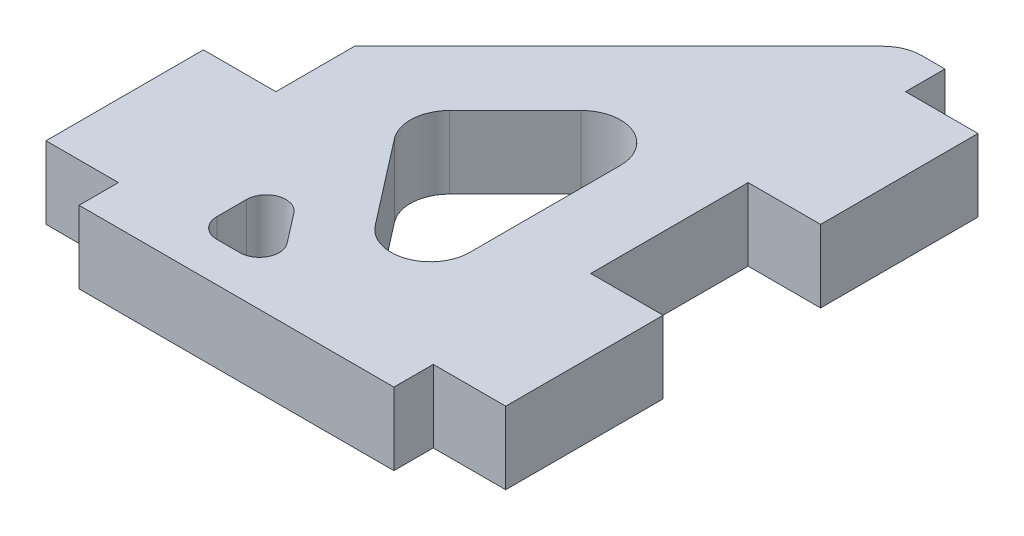
from build123d import *

# Parameters (mm, degrees)
BOSS_EXTRUDE1_DEPTH = 5.842
CUT_EXTRUDE1_DEPTH  = 39.907834083
FILLET1_R           = 3.175
FILLET2_R           = 1.5875
FILLET3_R           = 3.175
SKETCH3_W           = 25.4
SKETCH3_H           = 3.175
CUT_EXTRUDE2_DEPTH  = 39.907834083


with BuildPart() as part:
    # Sketch1 → Boss-Extrude1 (new body)
    with BuildSketch(Plane(origin=(0, 0, 0), x_dir=(1, 0, 0), z_dir=(0, 1, 0))):
        Polygon((15.875, -15.875), (-9.525, -15.875), (-9.525, -9.525), (-15.367, -9.525), (-15.367, 3.175), (-9.525, 3.175), (-9.525, 9.525), (12.7, 31.75), (15.875, 31.75), (15.875, 28.575), (21.717, 28.575), (21.717, 15.875), (15.875, 15.875), (15.875, 3.175), (21.717, 3.175), (21.717, -9.525), (15.875, -9.525), align=None)
    extrude(amount=BOSS_EXTRUDE1_DEPTH)

    # Sketch2 → Cut-Extrude1 (cut, through all)
    with BuildSketch(Plane(origin=(0, 5.842, 0), x_dir=(1, 0, 0), z_dir=(0, 1, 0))):
        Polygon((-3.175, 6.894743879), (9.525, 19.594743879), (9.525, -9.525), align=None)
        Polygon((-3.175, -0.889537058), (3.504177225, -9.525), (-3.175, -9.525), align=None)
    extrude(amount=-CUT_EXTRUDE1_DEPTH, mode=Mode.SUBTRACT)

    # Fillet1
    fillet1_edges = [part.edges().sort_by_distance(p)[0] for p in [
        (12.7, 2.921, -31.75),
    ]]
    fillet(fillet1_edges, radius=FILLET1_R)

    # Fillet2
    fillet2_edges = [part.edges().sort_by_distance(p)[0] for p in [
        (-3.175, 2.921, 9.525),
        (-3.175, 2.921, 0.889537058),
        (3.504177225, 2.921, 9.525),
    ]]
    fillet(fillet2_edges, radius=FILLET2_R)

    # Fillet3
    fillet3_edges = [part.edges().sort_by_distance(p)[0] for p in [
        (9.525, 2.921, 9.525),
        (-3.175, 2.921, -6.894743879),
        (9.525, 2.921, -19.594743879),
    ]]
    fillet(fillet3_edges, radius=FILLET3_R)

    # Sketch3 → Cut-Extrude2 (cut, through all)
    with BuildSketch(Plane(origin=(0, 5.842, 0), x_dir=(1, 0, 0), z_dir=(0, 1, 0))):
        with Locations((3.175, -14.2875)):
            Rectangle(SKETCH3_W, SKETCH3_H)
    extrude(amount=-CUT_EXTRUDE2_DEPTH, mode=Mode.SUBTRACT)


solid = part.part
